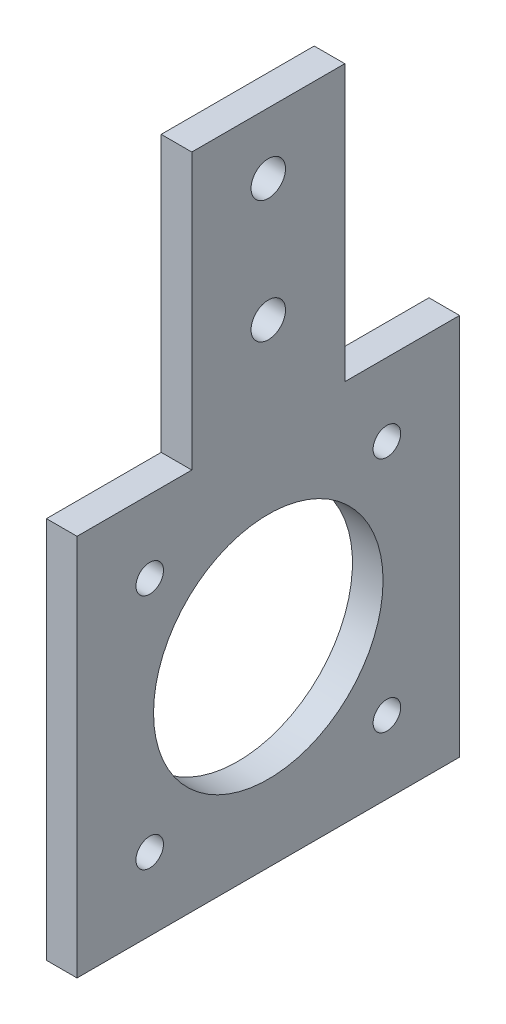
from build123d import *

# Parameters (mm, degrees)
SKETCH1_W           = 28
SKETCH1_H           = 28
SKETCH1_W_2         = 20
SKETCH1_H_2         = 20
BOSS_EXTRUDE1_DEPTH = 40
SKETCH2_R           = 2.25
CUT_EXTRUDE1_DEPTH  = 30
SKETCH5_W           = 50
SKETCH5_H           = 50
SKETCH5_R           = 1.8
SKETCH5_R_2         = 15
BOSS_EXTRUDE2_DEPTH = 4
SKETCH6_W           = 24
SKETCH6_H           = 28
CUT_EXTRUDE2_DEPTH  = 40
SKETCH7_W           = 4
SKETCH7_H           = 36
CUT_EXTRUDE3_DEPTH  = 4


with BuildPart() as part:
    # Sketch1 → Boss-Extrude1 (new body)
    with BuildSketch(Plane(origin=(0, 0, 0), x_dir=(1, 0, 0), z_dir=(0, 1, 0))):
        Rectangle(SKETCH1_W, SKETCH1_H)
        Rectangle(SKETCH1_W_2, SKETCH1_H_2, mode=Mode.SUBTRACT)
    extrude(amount=BOSS_EXTRUDE1_DEPTH)

    # Sketch2 → Cut-Extrude1 (cut)
    with BuildSketch(Plane.ZY.offset(14)):
        with Locations((0, 32)):
            Circle(SKETCH2_R)
        with Locations((0, 16)):
            Circle(SKETCH2_R)
    extrude(amount=-CUT_EXTRUDE1_DEPTH, mode=Mode.SUBTRACT)

    # Sketch5 → Boss-Extrude2 (add)
    with BuildSketch(Plane.ZY.offset(14)):
        with Locations((0, -21)):
            Rectangle(SKETCH5_W, SKETCH5_H)
        with Locations((-15.499780644, -5.500219356)):
            Circle(SKETCH5_R, mode=Mode.SUBTRACT)
        with Locations((15.499780644, -5.500219356)):
            Circle(SKETCH5_R, mode=Mode.SUBTRACT)
        with Locations((15.499780644, -36.499780644)):
            Circle(SKETCH5_R, mode=Mode.SUBTRACT)
        with Locations((-15.499780644, -36.499780644)):
            Circle(SKETCH5_R, mode=Mode.SUBTRACT)
        with Locations((0, -21)):
            Circle(SKETCH5_R_2, mode=Mode.SUBTRACT)
    extrude(amount=-BOSS_EXTRUDE2_DEPTH)

    # Sketch6 → Cut-Extrude2 (cut)
    with BuildSketch(Plane.XZ):
        with Locations((2, 0)):
            Rectangle(SKETCH6_W, SKETCH6_H)
    extrude(amount=-CUT_EXTRUDE2_DEPTH, mode=Mode.SUBTRACT)

    # Sketch7 → Cut-Extrude3 (cut)
    with BuildSketch(Plane.ZY.offset(14)):
        with Locations((-12, 22)):
            Rectangle(SKETCH7_W, SKETCH7_H)
        with Locations((12, 22)):
            Rectangle(SKETCH7_W, SKETCH7_H)
    extrude(amount=-CUT_EXTRUDE3_DEPTH, mode=Mode.SUBTRACT)


solid = part.part
